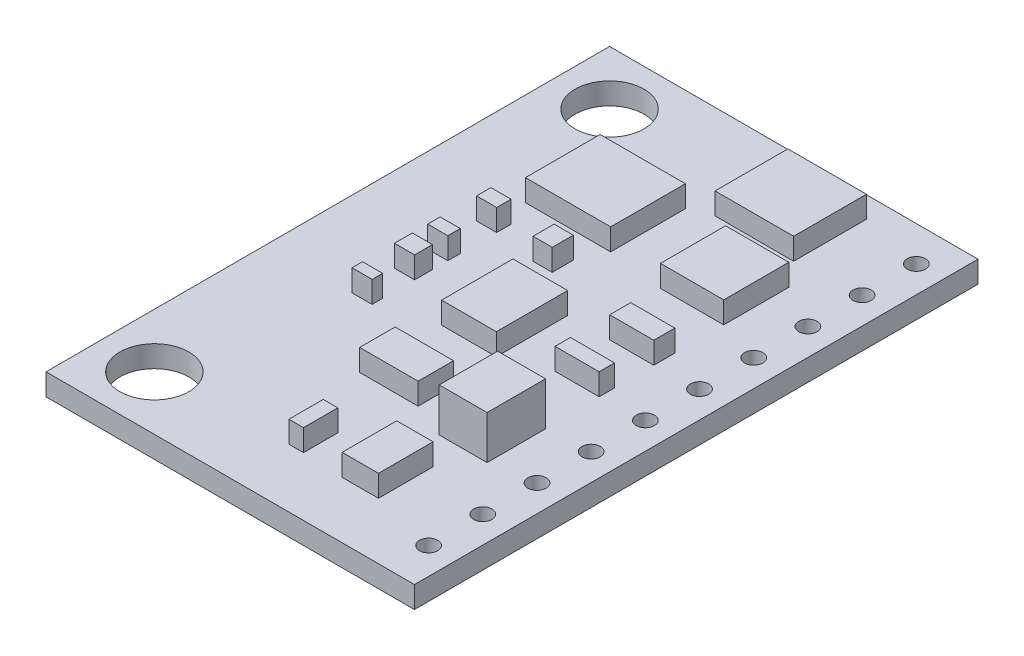
from build123d import *

# Parameters (mm, degrees)
SKETCH2_W           = 17
SKETCH2_H           = 26
BOSS_EXTRUDE1_DEPTH = 1
SKETCH3_R           = 0.825554505
SKETCH3_R_2         = 0.799067601
SKETCH3_R_3         = 0.4
SKETCH3_R_4         = 0.016836885
SKETCH3_W           = 3.624022482
SKETCH3_H           = 3.358967559
SKETCH3_W_2         = 2.916998144
SKETCH3_H_2         = 3.005392027
SKETCH3_W_3         = 3.9335278
SKETCH3_H_3         = 3.447361443
SKETCH3_W_4         = 0.928135773
SKETCH3_H_4         = 0.662954124
SKETCH3_W_5         = 0.883938831
SKETCH3_H_5         = 0.972332715
SKETCH3_W_6         = 2.524073743
SKETCH3_H_6         = 3.291762325
SKETCH3_H_7         = 0.574560241
SKETCH3_H_8         = 0.82518615
SKETCH3_H_9         = 0.486166357
SKETCH3_W_7         = 2.696013436
SKETCH3_H_10        = 1.635286838
SKETCH3_W_8         = 2.033059313
SKETCH3_H_11        = 0.972332714
SKETCH3_H_12        = 0.707151065
SKETCH3_W_9         = 1.676172691
SKETCH3_H_13        = 2.519225669
SKETCH3_W_10        = 0.670281766
SKETCH3_H_14        = 1.583920148
BOSS_EXTRUDE2_DEPTH = 1
SKETCH4_R           = 1.59
SKETCH4_R_2         = 0.42
CUT_EXTRUDE1_DEPTH  = 16.660459763
SKETCH5_W           = 2.209847079
SKETCH5_H           = 2.696013435
BOSS_EXTRUDE3_DEPTH = 2


with BuildPart() as part:
    # Sketch2 → Boss-Extrude1 (new body)
    with BuildSketch(Plane(origin=(0, 0, 0), x_dir=(1, 0, 0), z_dir=(0, 1, 0))):
        Rectangle(SKETCH2_W, SKETCH2_H)
    extrude(amount=BOSS_EXTRUDE1_DEPTH)

    # Sketch3 → Boss-Extrude2 (add)
    # profile 1 of 17: a face of its own
    with BuildSketch(Plane(origin=(0, 1, 0), x_dir=(1, 0, 0), z_dir=(0, 1, 0))):
        with Locations(Location((-6, -10.5, 0), (0, 0, 270))):
            Circle(SKETCH3_R)
    # profile 2 of 17: a face of its own
    with BuildSketch(Plane(origin=(0, 1, 0), x_dir=(1, 0, 0), z_dir=(0, 1, 0))):
        with Locations(Location((-6, 10.5, 0), (0, 0, 270))):
            Circle(SKETCH3_R_2)
    # profile 3 of 17: a face of its own
    with BuildSketch(Plane(origin=(0, 1, 0), x_dir=(1, 0, 0), z_dir=(0, 1, 0))):
        with Locations(Location((7.26674642, 11.385525432, 0), (0, 0, 270))):
            Circle(SKETCH3_R_3)
        with Locations(Location((7.26674642, 11.385525432, 0), (0, 0, 270))):
            Circle(SKETCH3_R_4, mode=Mode.SUBTRACT)
    # profile 4 of 17: a face of its own
    with BuildSketch(Plane(origin=(0, 1, 0), x_dir=(1, 0, 0), z_dir=(0, 1, 0))):
        with Locations((2.519162306, 10.342084328)):
            Rectangle(SKETCH3_W, SKETCH3_H)
    # profile 5 of 17: a face of its own
    with BuildSketch(Plane(origin=(0, 1, 0), x_dir=(1, 0, 0), z_dir=(0, 1, 0))):
        with Locations((3.800810248, 6.010784054)):
            Rectangle(SKETCH3_W_2, SKETCH3_H_2)
    # profile 6 of 17: a face of its own
    with BuildSketch(Plane(origin=(0, 1, 0), x_dir=(1, 0, 0), z_dir=(0, 1, 0))):
        with Locations((-2.232072277, 6.541147353)):
            Rectangle(SKETCH3_W_3, SKETCH3_H_3)
    # profile 7 of 17: a face of its own
    with BuildSketch(Plane(origin=(0, 1, 0), x_dir=(1, 0, 0), z_dir=(0, 1, 0))):
        with Locations((-4.132540764, 3.292672147)):
            Rectangle(SKETCH3_W_4, SKETCH3_H_4)
    # profile 8 of 17: a face of its own
    with BuildSketch(Plane(origin=(0, 1, 0), x_dir=(1, 0, 0), z_dir=(0, 1, 0))):
        with Locations((-1.237641092, 3.137982852)):
            Rectangle(SKETCH3_W_5, SKETCH3_H_5)
    # profile 9 of 17: a face of its own
    with BuildSketch(Plane(origin=(0, 1, 0), x_dir=(1, 0, 0), z_dir=(0, 1, 0))):
        with Locations((0.024395781, -0.364169856)):
            Rectangle(SKETCH3_W_6, SKETCH3_H_6)
    # profile 10 of 17: a face of its own
    with BuildSketch(Plane(origin=(0, 1, 0), x_dir=(1, 0, 0), z_dir=(0, 1, 0))):
        with Locations((-4.132540764, 0.994431186)):
            Rectangle(SKETCH3_W_4, SKETCH3_H_7)
    # profile 11 of 17: a face of its own
    with BuildSketch(Plane(origin=(0, 1, 0), x_dir=(1, 0, 0), z_dir=(0, 1, 0))):
        with Locations((-4.132540764, -0.412593075)):
            Rectangle(SKETCH3_W_4, SKETCH3_H_8)
    # profile 12 of 17: a face of its own
    with BuildSketch(Plane(origin=(0, 1, 0), x_dir=(1, 0, 0), z_dir=(0, 1, 0))):
        with Locations((-4.132540764, -2.54132414)):
            Rectangle(SKETCH3_W_4, SKETCH3_H_9)
    # profile 13 of 17: a face of its own
    with BuildSketch(Plane(origin=(0, 1, 0), x_dir=(1, 0, 0), z_dir=(0, 1, 0))):
        with Locations((0.110365627, -4.972155927)):
            Rectangle(SKETCH3_W_7, SKETCH3_H_10)
    # profile 14 of 17: a face of its own
    with BuildSketch(Plane(origin=(0, 1, 0), x_dir=(1, 0, 0), z_dir=(0, 1, 0))):
        with Locations((4.242779664, 1.767877663)):
            Rectangle(SKETCH3_W_8, SKETCH3_H_11)
    # profile 15 of 17: a face of its own
    with BuildSketch(Plane(origin=(0, 1, 0), x_dir=(1, 0, 0), z_dir=(0, 1, 0))):
        with Locations((4.242779664, -0.883938832)):
            Rectangle(SKETCH3_W_8, SKETCH3_H_12)
    # profile 16 of 17: a face of its own
    with BuildSketch(Plane(origin=(0, 1, 0), x_dir=(1, 0, 0), z_dir=(0, 1, 0))):
        with Locations((3.386837508, -9.126668435)):
            Rectangle(SKETCH3_W_9, SKETCH3_H_13)
    # profile 17 of 17: a face of its own
    with BuildSketch(Plane(origin=(0, 1, 0), x_dir=(1, 0, 0), z_dir=(0, 1, 0))):
        with Locations((0.335140883, -9.498757564)):
            Rectangle(SKETCH3_W_10, SKETCH3_H_14)
    extrude(amount=BOSS_EXTRUDE2_DEPTH)

    # Sketch4 → Cut-Extrude1 (cut, through all)
    with BuildSketch(Plane(origin=(0, 2, 0), x_dir=(1, 0, 0), z_dir=(0, 1, 0))):
        with Locations(Location((-6, 10.5, 0), (0, 0, 270))):
            Circle(SKETCH4_R)
        with Locations(Location((-6, -10.5, 0), (0, 0, 270))):
            Circle(SKETCH4_R)
        with Locations(Location((7.26674642, 11.385525432, 0), (0, 0, 270))):
            Circle(SKETCH4_R_2)
        with Locations(Location((7.26674642, 8.885525432, 0), (0, 0, 270))):
            Circle(SKETCH4_R_2)
        with Locations(Location((7.26674642, 6.385525432, 0), (0, 0, 270))):
            Circle(SKETCH4_R_2)
        with Locations(Location((7.26674642, 3.885525432, 0), (0, 0, 270))):
            Circle(SKETCH4_R_2)
        with Locations(Location((7.26674642, 1.385525432, 0), (0, 0, 270))):
            Circle(SKETCH4_R_2)
        with Locations(Location((7.26674642, -1.114474568, 0), (0, 0, 270))):
            Circle(SKETCH4_R_2)
        with Locations(Location((7.26674642, -3.614474568, 0), (0, 0, 270))):
            Circle(SKETCH4_R_2)
        with Locations(Location((7.26674642, -6.114474568, 0), (0, 0, 270))):
            Circle(SKETCH4_R_2)
        with Locations(Location((7.26674642, -8.614474568, 0), (0, 0, 270))):
            Circle(SKETCH4_R_2)
        with Locations(Location((7.26674642, -11.114474568, 0), (0, 0, 270))):
            Circle(SKETCH4_R_2)
    extrude(amount=-CUT_EXTRUDE1_DEPTH, mode=Mode.SUBTRACT)

    # Sketch5 → Boss-Extrude3 (add)
    with BuildSketch(Plane(origin=(0, 1, 0), x_dir=(1, 0, 0), z_dir=(0, 1, 0))):
        with Locations((4.19870945, -5.104746752)):
            Rectangle(SKETCH5_W, SKETCH5_H)
    extrude(amount=BOSS_EXTRUDE3_DEPTH)


solid = part.part
